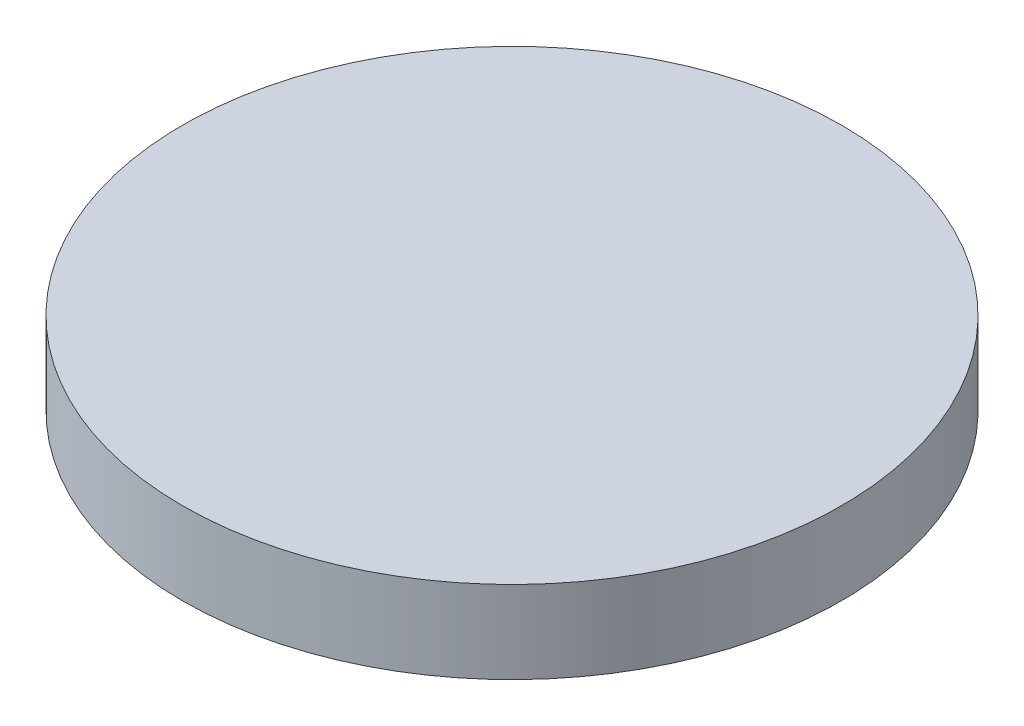
from build123d import *

# Parameters (mm, degrees)
SKETCH_1_R      = 10
EXTRUDE_1_DEPTH = 2.5


with BuildPart() as part:
    # 草图1 → 凸台-拉伸1 (new body)
    with BuildSketch(Plane(origin=(0, 0, 0), x_dir=(1, 0, 0), z_dir=(0, 1, 0))):
        with Locations(Location((0, 0, 0), (0, 0, 270))):
            Circle(SKETCH_1_R)
    extrude(amount=EXTRUDE_1_DEPTH)


solid = part.part
